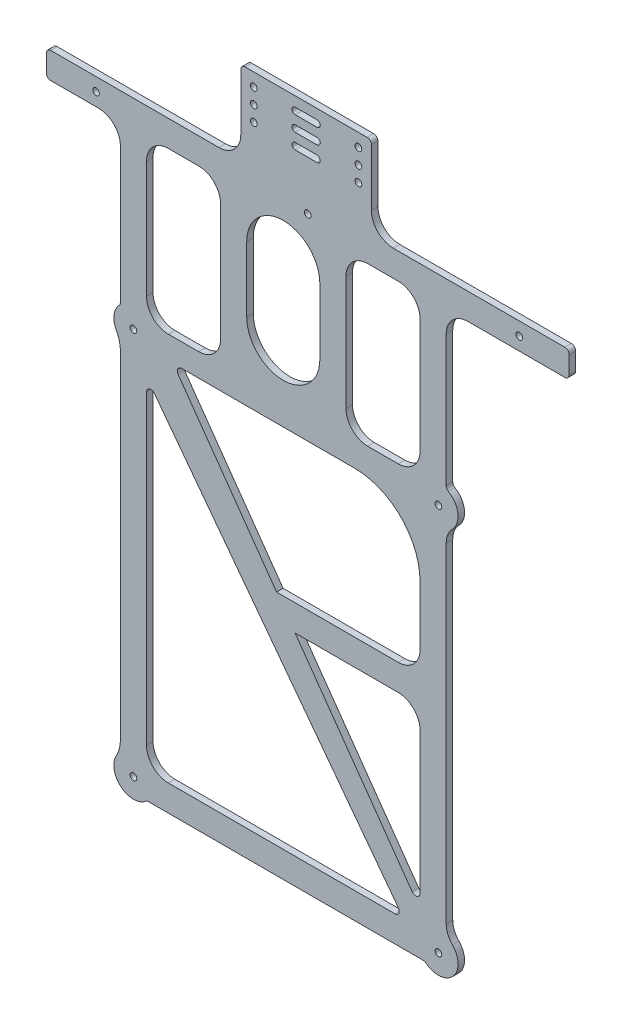
from build123d import *

# Parameters (mm, degrees)
EXTRUDE_1_DEPTH     = 3
SKETCH_2_R          = 1.525
SKETCH_2_R_2        = 1.55
CUT_EXTRUDE_1_DEPTH = 326.276245137
SKETCH_3_R          = 1.55
CUT_EXTRUDE_2_DEPTH = 326.276245137


with BuildPart() as part:
    # 草图1 → 凸台-拉伸1 (new body)
    with BuildSketch(Plane.XY):
        with BuildLine():
            Line((63.562092344, 7.87386317), (63.562092344, 94.767111078))
            Line((63.562092344, 94.767111078), (63.562092344, 159.160358986))
            ThreePointArc((63.562092344, 159.160358986), (64.30521832, 162.943252496), (66.424149005, 166.163912719))
            ThreePointArc((66.424149005, 166.163912719), (68.921247911, 173.655107589), (64.550802827, 180.231787094))
            ThreePointArc((64.550802827, 180.231787094), (63.826785594, 180.962931434), (63.562092344, 181.957270653))
            Line((63.562092344, 181.957270653), (63.562092344, 242.267111078))
            ThreePointArc((63.562092344, 242.267111078), (66.491024532, 249.33817889), (73.562092344, 252.267111078))
            Line((73.562092344, 252.267111078), (118, 252.267111078))
            ThreePointArc((118, 252.267111078), (119.414213562, 252.852897516), (120, 254.267111078))
            Line((120, 254.267111078), (120, 262.267111078))
            ThreePointArc((120, 262.267111078), (119.414213562, 263.681324641), (118, 264.267111078))
            Line((118, 264.267111078), (39.254483947, 264.267111078))
            ThreePointArc((39.254483947, 264.267111078), (32.183416135, 267.196043266), (29.254483947, 274.267111078))
            Line((29.254483947, 274.267111078), (29.254483947, 300.317111078))
            ThreePointArc((29.254483947, 300.317111078), (28.668697509, 301.731324641), (27.254483947, 302.317111078))
            Line((27.254483947, 302.317111078), (19.254483947, 302.317111078))
            Line((19.254483947, 302.317111078), (15.254483947, 302.317111078))
            Line((15.254483947, 302.317111078), (-28.745516053, 302.317111078))
            ThreePointArc((-28.745516053, 302.317111078), (-30.159729616, 301.731324641), (-30.745516053, 300.317111078))
            Line((-30.745516053, 300.317111078), (-30.745516053, 274.267111078))
            ThreePointArc((-30.745516053, 274.267111078), (-33.674448242, 267.196043266), (-40.745516053, 264.267111078))
            Line((-40.745516053, 264.267111078), (-50.745516053, 264.267111078))
            Line((-50.745516053, 264.267111078), (-118, 264.267111078))
            ThreePointArc((-118, 264.267111078), (-119.414213562, 263.681324641), (-120, 262.267111078))
            Line((-120, 262.267111078), (-120, 254.267111078))
            ThreePointArc((-120, 254.267111078), (-119.414213562, 252.852897516), (-118, 252.267111078))
            Line((-118, 252.267111078), (-96, 252.267111078))
            ThreePointArc((-96, 252.267111078), (-88.928932188, 249.33817889), (-86, 242.267111078))
            Line((-86, 242.267111078), (-86, 180.016945513))
            ThreePointArc((-86, 180.016945513), (-86.141359245, 179.278396568), (-86.545454545, 178.644248343))
            ThreePointArc((-86.545454545, 178.644248343), (-88.927223928, 173.609333888), (-87.889845719, 168.136945432))
            ThreePointArc((-87.889845719, 168.136945432), (-86.47997992, 164.570466876), (-86, 160.765587097))
            Line((-86, 160.765587097), (-86, 6.26863506))
            ThreePointArc((-86, 6.26863506), (-86.47997992, 2.46375528), (-87.889845719, -1.102723275))
            ThreePointArc((-87.889845719, -1.102723275), (-85.757688337, -12.35018789), (-74.310049328, -12.406013139))
            ThreePointArc((-74.310049328, -12.406013139), (-73.716746861, -12.071562552), (-73.045615845, -11.955596298))
            Line((-73.045615845, -11.955596298), (52.949414819, -11.955596298))
            ThreePointArc((52.949414819, -11.955596298), (53.472168985, -12.02512276), (53.958577903, -12.228868216))
            ThreePointArc((53.958577903, -12.228868216), (54.359402341, -12.475964985), (54.748150651, -12.741656151))
            ThreePointArc((54.748150651, -12.741656151), (66.831176576, -11.292498685), (66.424149005, 0.870309438))
            ThreePointArc((66.424149005, 0.870309438), (64.30521832, 4.090969661), (63.562092344, 7.87386317))
        make_face()
        with BuildLine():
            Line((-74, 150.511247137), (-74, 10.044403702))
            ThreePointArc((-74, 10.044403702), (-71.071067812, 2.97333589), (-64, 0.044403702))
            Line((-64, 0.044403702), (40.00099757, 0.044403702))
            ThreePointArc((40.00099757, 0.044403702), (41.791102309, 1.152481605), (41.597631541, 3.248878676))
            Line((41.597631541, 3.248878676), (-70.403366029, 151.715722111))
            ThreePointArc((-70.403366029, 151.715722111), (-72.635111037, 152.407726499), (-74, 150.511247137))
        make_face(mode=Mode.SUBTRACT)
        with BuildLine():
            Line((51.562092344, 137.909223904), (51.562092344, 110.767111078))
            ThreePointArc((51.562092344, 110.767111078), (48.633160156, 103.696043266), (41.562092344, 100.767111078))
            Line((41.562092344, 100.767111078), (-14.286066222, 100.767111078))
            Line((-14.286066222, 100.767111078), (-59.531026404, 164.754540121))
            ThreePointArc((-59.531026404, 164.754540121), (-59.674164346, 166.828634703), (-57.898021395, 167.909223904))
            Line((-57.898021395, 167.909223904), (21.562092344, 167.909223904))
            ThreePointArc((21.562092344, 167.909223904), (42.77529578, 159.12242734), (51.562092344, 137.909223904))
        make_face(mode=Mode.SUBTRACT)
        with BuildLine():
            Line((47.929087335, 12.779682035), (-5.800969535, 88.767111078))
            Line((-5.800969535, 88.767111078), (41.562092344, 88.767111078))
            ThreePointArc((41.562092344, 88.767111078), (48.633160156, 85.83817889), (51.562092344, 78.767111078))
            Line((51.562092344, 78.767111078), (51.562092344, 13.934365818))
            ThreePointArc((51.562092344, 13.934365818), (50.167893459, 12.028321483), (47.929087335, 12.779682035))
        make_face(mode=Mode.SUBTRACT)
        with BuildLine():
            Line((17.562092344, 242.267111078), (17.562092344, 189.673981411))
            ThreePointArc((17.562092344, 189.673981411), (20.491024532, 182.602913599), (27.562092344, 179.673981411))
            Line((27.562092344, 179.673981411), (41.562092344, 179.673981411))
            ThreePointArc((41.562092344, 179.673981411), (48.633160156, 182.602913599), (51.562092344, 189.673981411))
            Line((51.562092344, 189.673981411), (51.562092344, 242.267111078))
            ThreePointArc((51.562092344, 242.267111078), (48.633160156, 249.33817889), (41.562092344, 252.267111078))
            Line((41.562092344, 252.267111078), (27.562092344, 252.267111078))
            ThreePointArc((27.562092344, 252.267111078), (20.491024532, 249.33817889), (17.562092344, 242.267111078))
        make_face(mode=Mode.SUBTRACT)
        with BuildLine():
            Line((-40, 242.267111078), (-40, 188.467111078))
            ThreePointArc((-40, 188.467111078), (-42.928932188, 181.396043266), (-50, 178.467111078))
            Line((-50, 178.467111078), (-64, 178.467111078))
            ThreePointArc((-64, 178.467111078), (-71.071067812, 181.396043266), (-74, 188.467111078))
            Line((-74, 188.467111078), (-74, 242.267111078))
            ThreePointArc((-74, 242.267111078), (-71.071067812, 249.33817889), (-64, 252.267111078))
            Line((-64, 252.267111078), (-50, 252.267111078))
            ThreePointArc((-50, 252.267111078), (-42.928932188, 249.33817889), (-40, 242.267111078))
        make_face(mode=Mode.SUBTRACT)
    extrude(amount=-EXTRUDE_1_DEPTH)

    # 草图2 → 切除-拉伸1 (cut, through all)
    with BuildSketch(Plane(origin=(0, 0, -3), x_dir=(-1, 0, 0), z_dir=(0, 0, -1))):
        with Locations((-60, 172.467111078)):
            Circle(SKETCH_2_R)
        with Locations((-60, -5.432888922)):
            Circle(SKETCH_2_R)
        with Locations((80, -5.432888922)):
            Circle(SKETCH_2_R)
        with Locations((80, 172.467111078)):
            Circle(SKETCH_2_R)
        with Locations((0, 258.267111078)):
            Circle(SKETCH_2_R_2)
        with Locations((-97.15, 258.267111078)):
            Circle(SKETCH_2_R)
        with Locations((97.15, 258.267111078)):
            Circle(SKETCH_2_R)
        with BuildLine():
            Line((28, 233.267111078), (28, 203.267111078))
            ThreePointArc((28, 203.267111078), (11.218953828, 186.486064906), (-5.562092344, 203.267111078))
            Line((-5.562092344, 203.267111078), (-5.562092344, 233.267111078))
            ThreePointArc((-5.562092344, 233.267111078), (11.218953828, 250.04815725), (28, 233.267111078))
        make_face()
    extrude(amount=-CUT_EXTRUDE_1_DEPTH, mode=Mode.SUBTRACT)

    # 草图3 → 切除-拉伸2 (cut, through all)
    with BuildSketch(Plane(origin=(0, 0, -3), x_dir=(-1, 0, 0), z_dir=(0, 0, -1))):
        with Locations((-23.254483947, 296.317111078)):
            Circle(SKETCH_3_R)
        with Locations((24.745516053, 296.317111078)):
            Circle(SKETCH_3_R)
        with Locations((-23.254483947, 289.317111078)):
            Circle(SKETCH_3_R)
        with Locations((24.745516053, 289.317111078)):
            Circle(SKETCH_3_R)
        with Locations((-23.254483947, 282.317111078)):
            Circle(SKETCH_3_R)
        with Locations((24.745516053, 282.317111078)):
            Circle(SKETCH_3_R)
        with BuildLine():
            Line((-4.254483947, 297.817111078), (5.745516053, 297.817111078))
            ThreePointArc((5.745516053, 297.817111078), (7.245516053, 296.317111078), (5.745516053, 294.817111078))
            Line((5.745516053, 294.817111078), (-4.254483947, 294.817111078))
            ThreePointArc((-4.254483947, 294.817111078), (-5.754483947, 296.317111078), (-4.254483947, 297.817111078))
        make_face()
        with BuildLine():
            Line((-4.254483947, 290.817111078), (5.745516053, 290.817111078))
            ThreePointArc((5.745516053, 290.817111078), (7.245516053, 289.317111078), (5.745516053, 287.817111078))
            Line((5.745516053, 287.817111078), (-4.254483947, 287.817111078))
            ThreePointArc((-4.254483947, 287.817111078), (-5.754483947, 289.317111078), (-4.254483947, 290.817111078))
        make_face()
        with BuildLine():
            Line((-4.254483947, 283.817111078), (5.745516053, 283.817111078))
            ThreePointArc((5.745516053, 283.817111078), (7.245516053, 282.317111078), (5.745516053, 280.817111078))
            Line((5.745516053, 280.817111078), (-4.254483947, 280.817111078))
            ThreePointArc((-4.254483947, 280.817111078), (-5.754483947, 282.317111078), (-4.254483947, 283.817111078))
        make_face()
    extrude(amount=-CUT_EXTRUDE_2_DEPTH, mode=Mode.SUBTRACT)


solid = part.part
